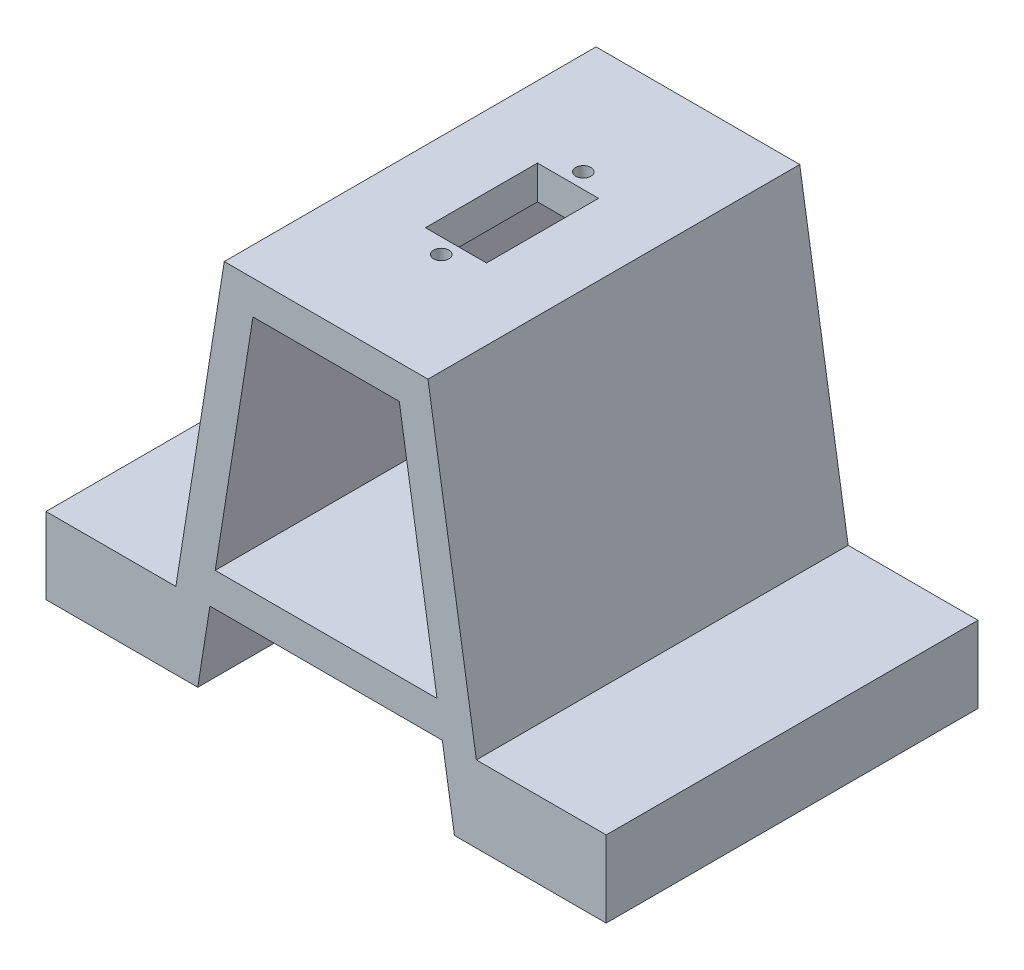
from build123d import *

# Parameters (mm, degrees)
BOSS_EXTRUDE1_DEPTH = 36.5
CUT_EXTRUDE1_DEPTH  = 119.232821162
SKETCH3_W           = 12
SKETCH3_H           = 22
CUT_EXTRUDE4_DEPTH  = 7
SKETCH7_R           = 1.5
CUT_EXTRUDE10_DEPTH = 8


with BuildPart() as part:
    # Sketch1 → Boss-Extrude1 (new, symmetric)
    with BuildSketch(Plane.XY):
        Polygon((-55, 0), (55, 0), (55, 15), (29.503066419, 15), (20, 75), (-20, 75), (-29.503066419, 15), (-55, 15), align=None)
    extrude(amount=BOSS_EXTRUDE1_DEPTH, both=True)

    # Sketch2 → Cut-Extrude1 (cut, through all)
    with BuildSketch(Plane.XY.offset(36.5)):
        Polygon((-22.820796589, 15), (22.820796589, 15), (25.196563194, 0), (-25.196563194, 0), align=None)
        Polygon((-21.775459283, 21.6), (21.775459283, 21.6), (14.363067476, 68.4), (-14.363067476, 68.4), align=None)
    extrude(amount=-CUT_EXTRUDE1_DEPTH, mode=Mode.SUBTRACT)

    # Sketch3 → Cut-Extrude4 (cut)
    with BuildSketch(Plane(origin=(0, 75, 0), x_dir=(1, 0, 0), z_dir=(0, 1, 0))):
        Rectangle(SKETCH3_W, SKETCH3_H)
    extrude(amount=-CUT_EXTRUDE4_DEPTH, mode=Mode.SUBTRACT)

    # Sketch7 → Cut-Extrude10 (cut)
    with BuildSketch(Plane(origin=(0, 75, 0), x_dir=(1, 0, 0), z_dir=(0, 1, 0))):
        with Locations(Location((0, 14, 0), (0, 0, 270))):
            Circle(SKETCH7_R)
        with Locations(Location((0.102187059, -13.999627059, 0), (0, 0, 270))):
            Circle(SKETCH7_R)
    extrude(amount=-CUT_EXTRUDE10_DEPTH, mode=Mode.SUBTRACT)


solid = part.part
